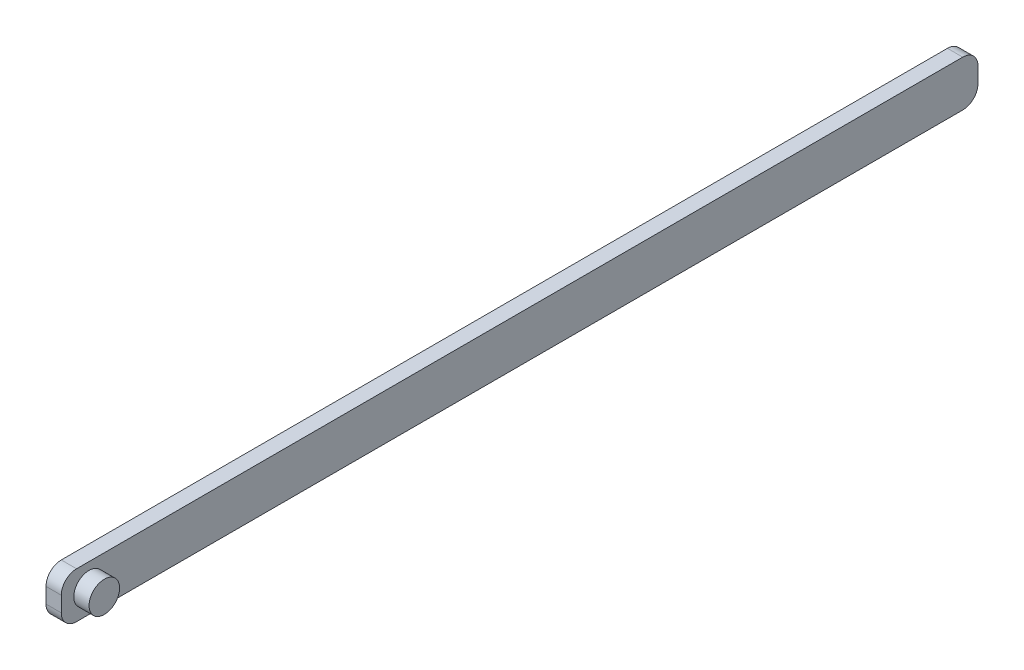
from build123d import *

# Parameters (mm, degrees)
BOSS_EXTRUDE1_DEPTH = 10
SKETCH2_R           = 10
BOSS_EXTRUDE2_DEPTH = 10


with BuildPart() as part:
    # Sketch1 → Boss-Extrude1 (new body)
    with BuildSketch(Plane(origin=(0, 0, 0), x_dir=(0, 0, -1), z_dir=(1, 0, 0))):
        with BuildLine():
            Line((-19.310323675, 18.90886515), (560.689676325, 18.90886515))
            ThreePointArc((560.689676325, 18.90886515), (567.760744137, 15.979932962), (570.689676325, 8.90886515))
            Line((570.689676325, 8.90886515), (570.689676325, -1.09113485))
            ThreePointArc((570.689676325, -1.09113485), (567.760744137, -8.162202662), (560.689676325, -11.09113485))
            Line((560.689676325, -11.09113485), (-19.310323675, -11.09113485))
            ThreePointArc((-19.310323675, -11.09113485), (-26.381391487, -8.162202662), (-29.310323675, -1.09113485))
            Line((-29.310323675, -1.09113485), (-29.310323675, 8.90886515))
            ThreePointArc((-29.310323675, 8.90886515), (-26.381391487, 15.979932962), (-19.310323675, 18.90886515))
        make_face()
    extrude(amount=BOSS_EXTRUDE1_DEPTH)

    # Sketch2 → Boss-Extrude2 (add)
    with BuildSketch(Plane(origin=(10, 0, 0), x_dir=(0, 0, -1), z_dir=(1, 0, 0))):
        with Locations((-11.135288293, 3.90886515)):
            Circle(SKETCH2_R)
    extrude(amount=BOSS_EXTRUDE2_DEPTH)


solid = part.part
